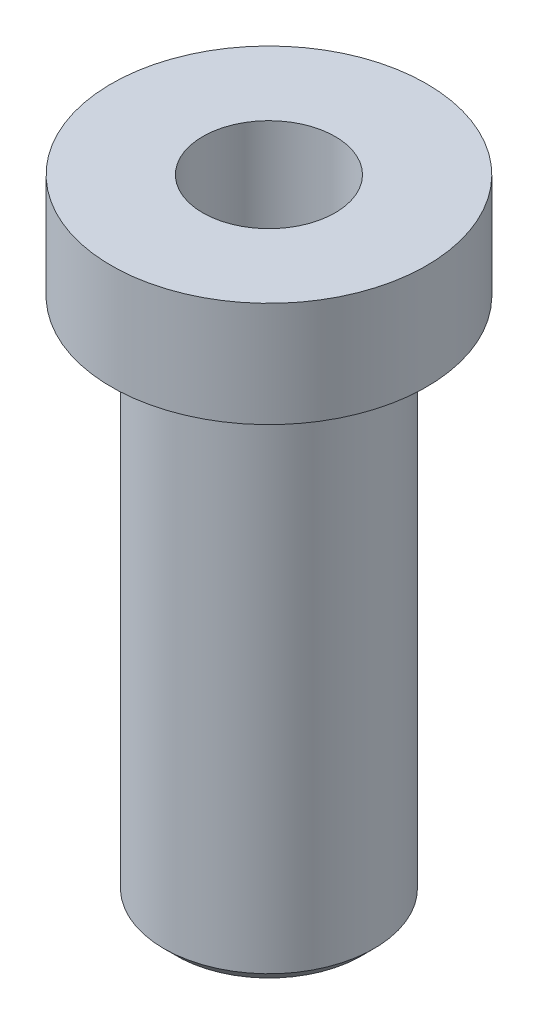
from build123d import *

# Parameters (mm, degrees)
SKETCH2_R          = 0.315
CUT_EXTRUDE1_DEPTH = 4.181980515
CHAMFER1_SIZE      = 0.06


with BuildPart() as part:
    # Sketch1 → Revolve1 (revolve)
    with BuildSketch(Plane.XY, mode=Mode.PRIVATE) as revolve1_sk:
        Polygon((0, 0), (0, 3), (0.75, 3), (0.75, 2.5), (0.5, 2.5), (0.5, 0), align=None)
    revolve(revolve1_sk.sketch.rotate(Axis((0, 0, 0), (0, 1, 0)), 90), axis=Axis((0, 0, 0), (0, 1, 0)))

    # Sketch2 → Cut-Extrude1 (cut, through all)
    with BuildSketch(Plane(origin=(0, 3, 0), x_dir=(1, 0, 0), z_dir=(0, 1, 0))):
        with Locations(Location((0, 0, 0), (0, 0, 270))):
            Circle(SKETCH2_R)
    extrude(amount=-CUT_EXTRUDE1_DEPTH, mode=Mode.SUBTRACT)

    # Chamfer1
    chamfer1_edges = [part.edges().sort_by_distance(p)[0] for p in [
        (0, 0, 0.5),
    ]]
    chamfer(chamfer1_edges, length=CHAMFER1_SIZE)


solid = part.part
